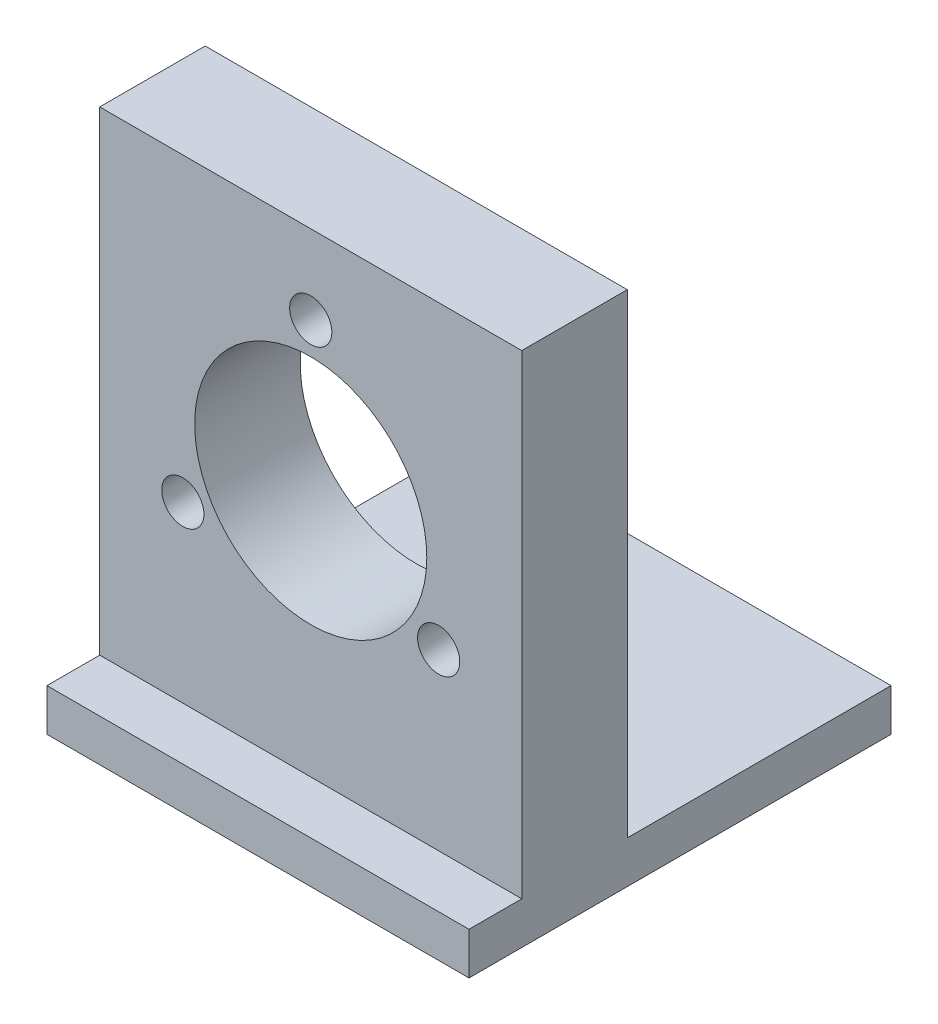
from build123d import *

# Parameters (mm, degrees)
SKETCH2_W           = 40
SKETCH2_H           = 40
BOSS_EXTRUDE1_DEPTH = 4
SKETCH3_W           = 40
SKETCH3_H           = 10
BOSS_EXTRUDE2_DEPTH = 45
CUT_EXTRUDE1_REACH  = 68.312
SKETCH4_R           = 11
SKETCH4_R_2         = 2


with BuildPart() as part:
    # Sketch2 → Boss-Extrude1 (new body)
    with BuildSketch(Plane(origin=(0, 0, 0), x_dir=(1, 0, 0), z_dir=(0, 1, 0))):
        with Locations((7.772848934, 5.794927438)):
            Rectangle(SKETCH2_W, SKETCH2_H)
    extrude(amount=BOSS_EXTRUDE1_DEPTH)

    # Sketch3 → Boss-Extrude2 (add)
    with BuildSketch(Plane(origin=(0, 4, 0), x_dir=(1, 0, 0), z_dir=(0, 1, 0))):
        with Locations((7.772848934, -4.205072562)):
            Rectangle(SKETCH3_W, SKETCH3_H)
    extrude(amount=BOSS_EXTRUDE2_DEPTH)

    # Sketch4 → Cut-Extrude1 (cut, up to next)
    with BuildSketch(Plane.XY.offset(9.205072562), mode=Mode.PRIVATE) as cut_extrude1_sk1:
        with Locations((7.772848934, 27.5)):
            Circle(SKETCH4_R)
    cut_extrude1_tool1 = extrude(cut_extrude1_sk1.sketch, amount=-CUT_EXTRUDE1_REACH, mode=Mode.PRIVATE) & part.part
    # Sketch4 → Cut-Extrude1 (cut, up to next)
    with BuildSketch(Plane.XY.offset(9.205072562), mode=Mode.PRIVATE) as cut_extrude1_sk2:
        with Locations((19.897204587, 20.5)):
            Circle(SKETCH4_R_2)
    cut_extrude1_tool2 = extrude(cut_extrude1_sk2.sketch, amount=-CUT_EXTRUDE1_REACH, mode=Mode.PRIVATE) & part.part
    # Sketch4 → Cut-Extrude1 (cut, up to next)
    with BuildSketch(Plane.XY.offset(9.205072562), mode=Mode.PRIVATE) as cut_extrude1_sk3:
        with Locations((-4.351506719, 20.5)):
            Circle(SKETCH4_R_2)
    cut_extrude1_tool3 = extrude(cut_extrude1_sk3.sketch, amount=-CUT_EXTRUDE1_REACH, mode=Mode.PRIVATE) & part.part
    # Sketch4 → Cut-Extrude1 (cut, up to next)
    with BuildSketch(Plane.XY.offset(9.205072562), mode=Mode.PRIVATE) as cut_extrude1_sk4:
        with Locations((7.772848934, 41.5)):
            Circle(SKETCH4_R_2)
    cut_extrude1_tool4 = extrude(cut_extrude1_sk4.sketch, amount=-CUT_EXTRUDE1_REACH, mode=Mode.PRIVATE) & part.part
    add(cut_extrude1_tool1.solids().sort_by_distance((7.772849, 27.5, 9.205073))[0], mode=Mode.SUBTRACT)
    add(cut_extrude1_tool2.solids().sort_by_distance((19.897205, 20.5, 9.205073))[0], mode=Mode.SUBTRACT)
    add(cut_extrude1_tool3.solids().sort_by_distance((-4.351507, 20.5, 9.205073))[0], mode=Mode.SUBTRACT)
    add(cut_extrude1_tool4.solids().sort_by_distance((7.772849, 41.5, 9.205073))[0], mode=Mode.SUBTRACT)


solid = part.part
